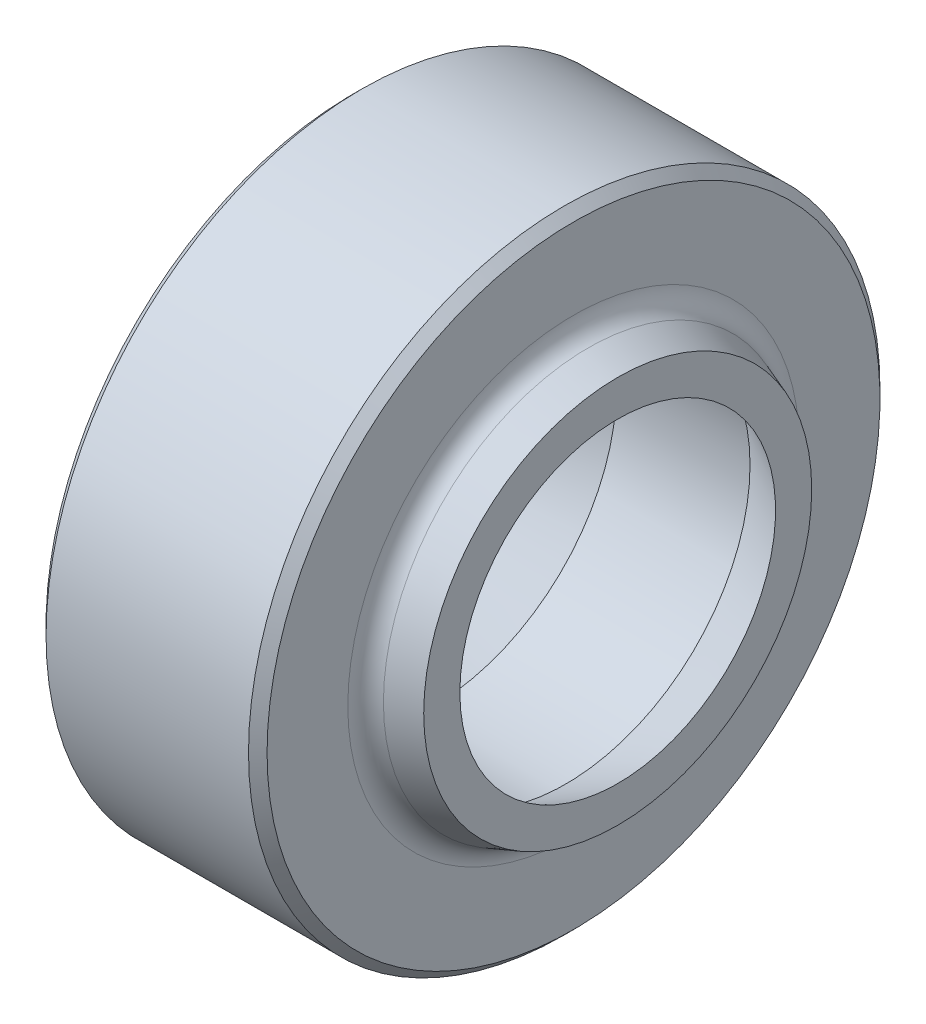
from build123d import *

# Parameters (mm, degrees)
ZAOBLIT1_R   = 0.294
ZKOSIT1_SIZE = 0.147
ZAOBLIT2_R   = 0.3528


with BuildPart() as part:
    # Skica1 → Otočit kolem osy1 (revolve)
    with BuildSketch(Plane.XY, mode=Mode.PRIVATE) as oto_it_kolem_osy1_sk:
        Polygon((0, 5), (3.5, 5), (3.5, 3.327141994), (4.2, 3.07236283), (4.2, 2.5), (3.375703588, 2.92), (1.26, 2.92), (0.42, 2.5), (0.168, 2.752), (0.168, 3.222223069), (2.333333333, 3.802422387), (0, 4.42763717), align=None)
    revolve(oto_it_kolem_osy1_sk.sketch.rotate(Axis((0, 0, 0), (1, 0, 0)), 90), axis=Axis((0, 0, 0), (1, 0, 0)))

    # Zaoblit1
    zaoblit1_edges = [part.edges().sort_by_distance(p)[0] for p in [
        (2.333333333, 0, -3.802422387),
    ]]
    fillet(zaoblit1_edges, radius=ZAOBLIT1_R)

    # Zkosit1
    zkosit1_edges = [part.edges().sort_by_distance(p)[0] for p in [
        (3.5, 0, -5),
        (0, 0, -5),
    ]]
    chamfer(zkosit1_edges, length=ZKOSIT1_SIZE)

    # Zaoblit2
    zaoblit2_edges = [part.edges().sort_by_distance(p)[0] for p in [
        (3.5, 0, -3.327141994),
    ]]
    fillet(zaoblit2_edges, radius=ZAOBLIT2_R)


solid = part.part
